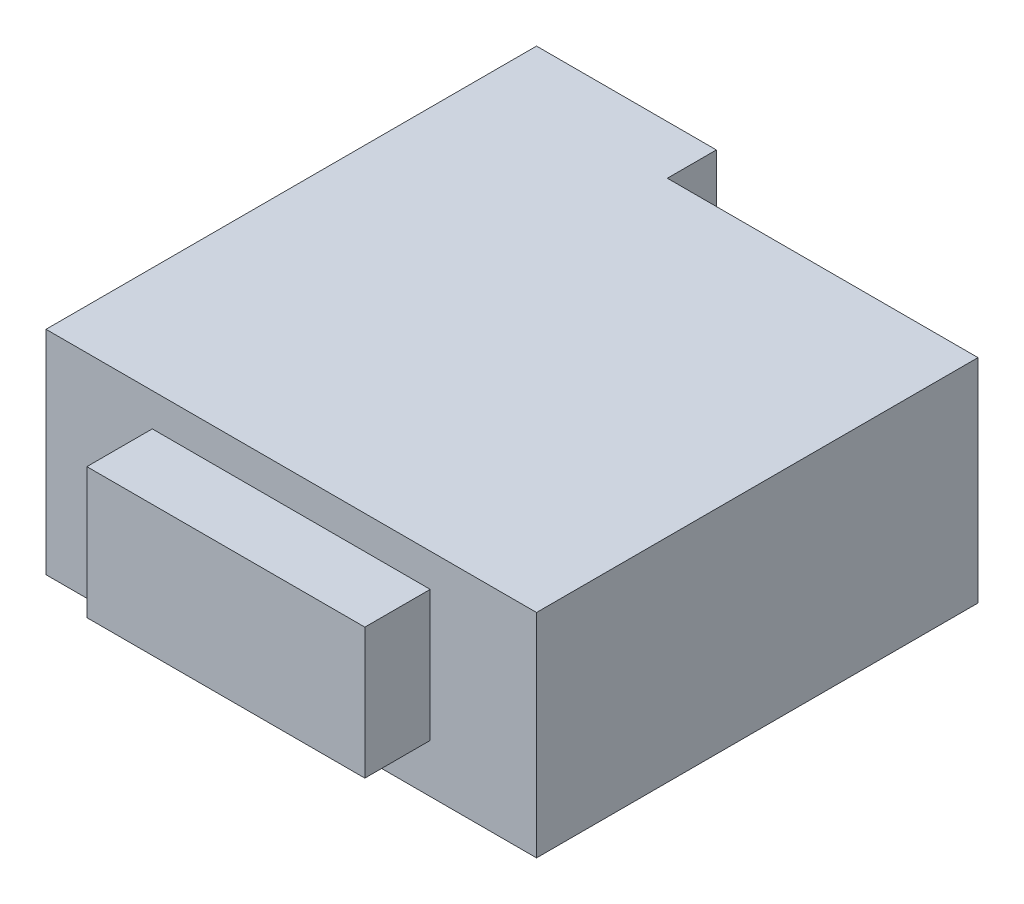
from build123d import *

# Parameters (mm, degrees)
SKETCH1_W           = 300
SKETCH1_H           = 270
BOSS_EXTRUDE1_DEPTH = 130
SKETCH2_W           = 110
SKETCH2_H           = 130
BOSS_EXTRUDE2_DEPTH = 30
SKETCH3_W           = 170
SKETCH3_H           = 80
BOSS_EXTRUDE3_DEPTH = 40


with BuildPart() as part:
    # Sketch1 → Boss-Extrude1 (new body)
    with BuildSketch(Plane(origin=(0, 0, 0), x_dir=(1, 0, 0), z_dir=(0, 1, 0))):
        Rectangle(SKETCH1_W, SKETCH1_H)
    extrude(amount=BOSS_EXTRUDE1_DEPTH)

    # Sketch2 → Boss-Extrude2 (add)
    with BuildSketch(Plane(origin=(0, 0, -135), x_dir=(-1, 0, 0), z_dir=(0, 0, -1))):
        with Locations((95, 65)):
            Rectangle(SKETCH2_W, SKETCH2_H)
    extrude(amount=BOSS_EXTRUDE2_DEPTH)

    # Sketch3 → Boss-Extrude3 (add)
    with BuildSketch(Plane.XY.offset(135)):
        with Locations((0, 69.751247573)):
            Rectangle(SKETCH3_W, SKETCH3_H)
    extrude(amount=BOSS_EXTRUDE3_DEPTH)


solid = part.part
